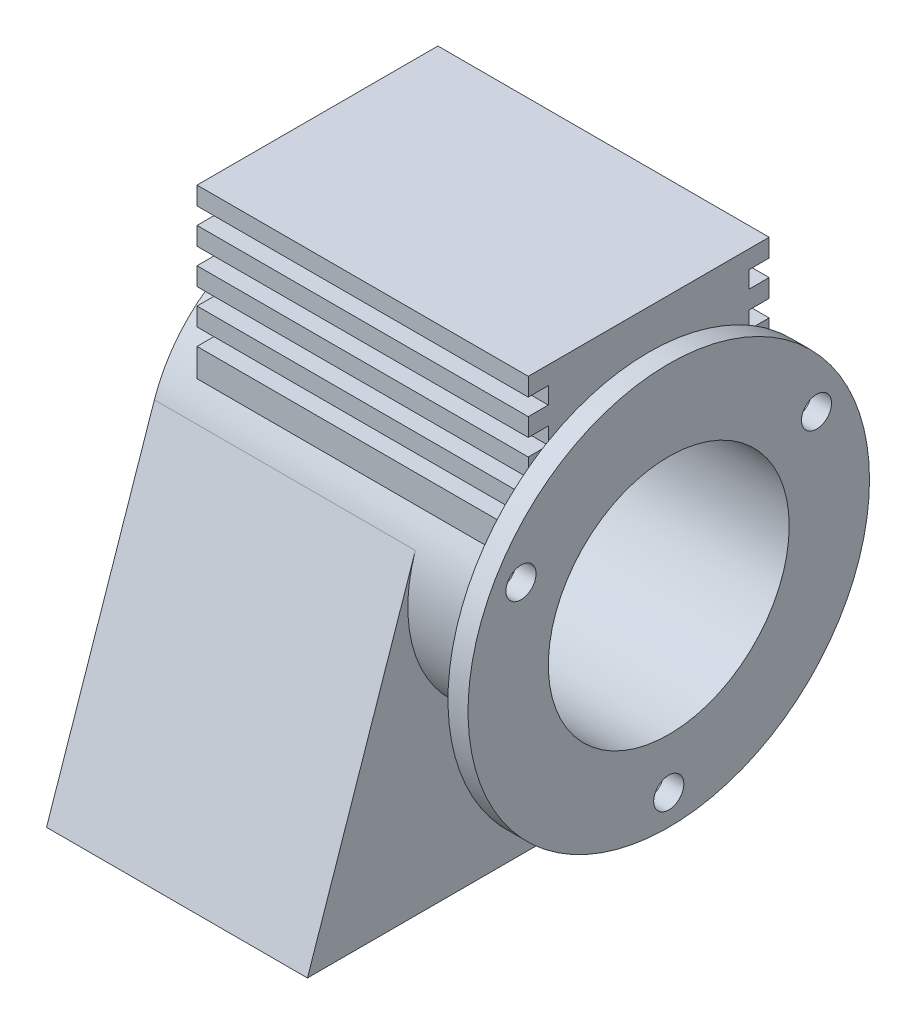
from build123d import *
from build123d.topology import SkipClean

# Parameters (mm, degrees)
SKETCH1_R           = 50
SKETCH1_R_2         = 30
BOSS_EXTRUDE1_DEPTH = 5
BOSS_EXTRUDE2_START = 82.5
SKETCH2_R           = 35
SKETCH2_R_2         = 30
BOSS_EXTRUDE2_DEPTH = 82.5
BOSS_EXTRUDE3_DEPTH = 65
SKETCH4_R           = 3.75
CUT_EXTRUDE2_DEPTH  = 5
BOSS_EXTRUDE4_START = 82.5
BOSS_EXTRUDE4_DEPTH = 82.5
SKETCH7_R           = 7.5
CUT_EXTRUDE3_DEPTH  = 112.271065421
CUT_EXTRUDE4_START  = -60
SKETCH8_R           = 30
CUT_EXTRUDE4_DEPTH  = 60


with BuildPart() as part:
    # Sketch1 → Boss-Extrude1 (new body)
    with BuildSketch(Plane(origin=(0, 0, 0), x_dir=(0, 0, -1), z_dir=(1, 0, 0))):
        Circle(SKETCH1_R)
        Circle(SKETCH1_R_2, mode=Mode.SUBTRACT)
    extrude(amount=BOSS_EXTRUDE1_DEPTH)

    # Sketch2 → Boss-Extrude2 (add)
    with SkipClean():  # the faces are left unmerged after this step: merging them gives an invalid solid
        with BuildSketch(Plane.ZY.offset(BOSS_EXTRUDE2_START)):
            with Locations(Location((0, 0, 0), (0, 0, 180))):
                Circle(SKETCH2_R)
            Circle(SKETCH2_R_2, mode=Mode.SUBTRACT)
        extrude(amount=-BOSS_EXTRUDE2_DEPTH)

    # Sketch3 → Boss-Extrude3 (add)
    with SkipClean():  # the faces are left unmerged after this step: merging them gives an invalid solid
        with BuildSketch(Plane.ZY.offset(90)):
            with BuildLine():
                Line((-60, -67.5), (60, -67.5))
                Line((60, -67.5), (33.12648335, 11.29761483))
                ThreePointArc((33.12648335, 11.29761483), (0, 35), (-33.12648335, 11.29761483))
                Line((-33.12648335, 11.29761483), (-60, -67.5))
            make_face()
        extrude(amount=-BOSS_EXTRUDE3_DEPTH)

    # Sketch4 → Cut-Extrude2 (cut)
    with SkipClean():  # the faces are left unmerged after this step: merging them gives an invalid solid
        with BuildSketch(Plane(origin=(5, 0, 0), x_dir=(0, 0, -1), z_dir=(1, 0, 0))):
            with Locations((0, -42.5)):
                Circle(SKETCH4_R)
            with Locations((-36.806079661, 21.25)):
                Circle(SKETCH4_R)
            with Locations((36.806079661, 21.25)):
                Circle(SKETCH4_R)
        extrude(amount=-CUT_EXTRUDE2_DEPTH, mode=Mode.SUBTRACT)

    # Sketch6 → Boss-Extrude4 (add)
    with SkipClean():  # the faces are left unmerged after this step: merging them gives an invalid solid
        with BuildSketch(Plane.ZY.offset(BOSS_EXTRUDE4_START)):
            with BuildLine():
                Line((-25, 25), (-30, 25))
                Line((-30, 25), (-30, 18.027756377))
                ThreePointArc((-30, 18.027756377), (0, 35), (30, 18.027756377))
                Line((30, 18.027756377), (30, 25))
                Line((30, 25), (25, 25))
                Line((25, 25), (25, 29.2))
                Line((25, 29.2), (30, 29.2))
                Line((30, 29.2), (30, 33.7))
                Line((30, 33.7), (25, 33.7))
                Line((25, 33.7), (25, 37.9))
                Line((25, 37.9), (30, 37.9))
                Line((30, 37.9), (30, 42.4))
                Line((30, 42.4), (25, 42.4))
                Line((25, 42.4), (25, 46.6))
                Line((25, 46.6), (30, 46.6))
                Line((30, 46.6), (30, 51.1))
                Line((30, 51.1), (25, 51.1))
                Line((25, 51.1), (25, 55.3))
                Line((25, 55.3), (30, 55.3))
                Line((30, 55.3), (30, 59.8))
                Line((30, 59.8), (-30, 59.8))
                Line((-30, 59.8), (-30, 55.3))
                Line((-30, 55.3), (-25, 55.3))
                Line((-25, 55.3), (-25, 51.1))
                Line((-25, 51.1), (-30, 51.1))
                Line((-30, 51.1), (-30, 46.6))
                Line((-30, 46.6), (-25, 46.6))
                Line((-25, 46.6), (-25, 42.4))
                Line((-25, 42.4), (-30, 42.4))
                Line((-30, 42.4), (-30, 37.9))
                Line((-30, 37.9), (-25, 37.9))
                Line((-25, 37.9), (-25, 33.7))
                Line((-25, 33.7), (-30, 33.7))
                Line((-30, 33.7), (-30, 29.2))
                Line((-30, 29.2), (-25, 29.2))
                Line((-25, 29.2), (-25, 25))
            make_face()
        extrude(amount=-BOSS_EXTRUDE4_DEPTH)

    # Sketch7 → Cut-Extrude3 (cut, through all)
    with SkipClean():  # the faces are left unmerged after this step: merging them gives an invalid solid
        with BuildSketch(Plane(origin=(-25, 0, 0), x_dir=(0, 0, -1), z_dir=(1, 0, 0))):
            Circle(SKETCH7_R)
        extrude(amount=-CUT_EXTRUDE3_DEPTH, mode=Mode.SUBTRACT)

    # Sketch8 → Cut-Extrude4 (cut)
    with SkipClean():  # the faces are left unmerged after this step: merging them gives an invalid solid
        with BuildSketch(Plane(origin=(-25, 0, 0), x_dir=(0, 0, -1), z_dir=(1, 0, 0)).offset(CUT_EXTRUDE4_START)):
            Circle(SKETCH8_R)
        extrude(amount=CUT_EXTRUDE4_DEPTH, mode=Mode.SUBTRACT)


solid = part.part
